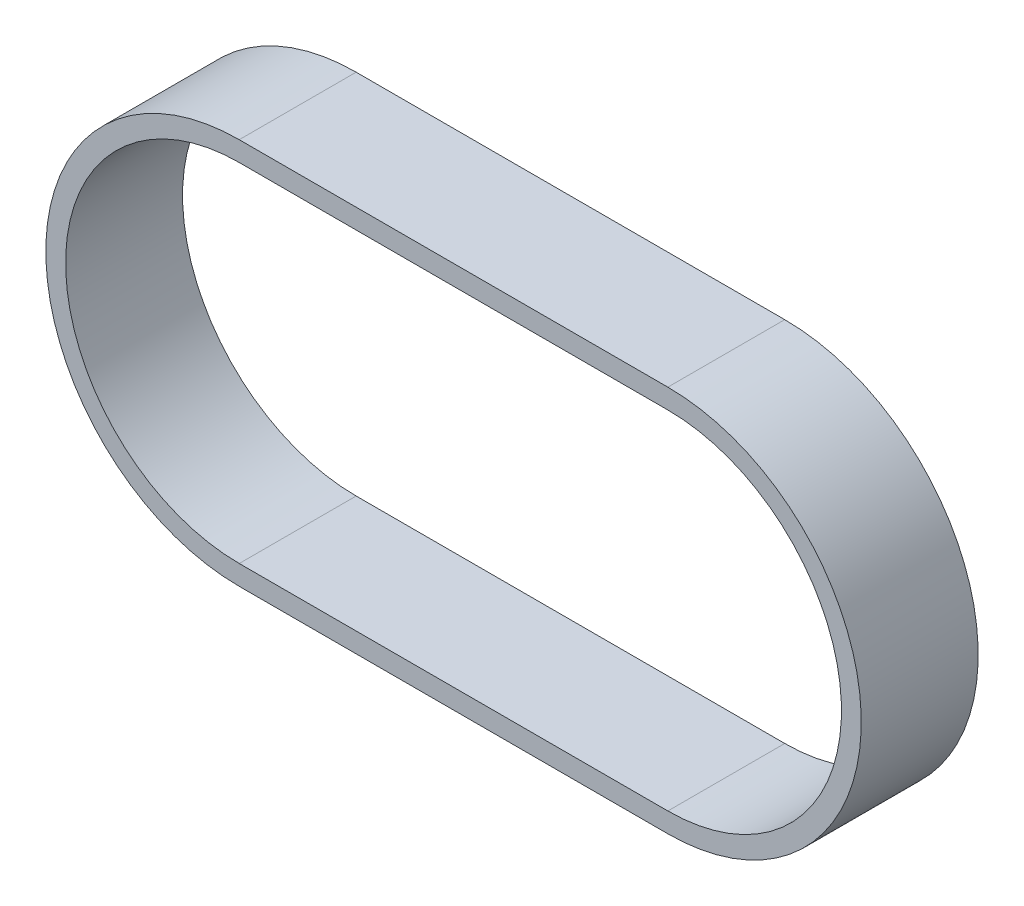
from build123d import *

# Parameters (mm, degrees)
BOSS_EXTRUDE1_DEPTH = 15


with BuildPart() as part:
    # Sketch1 → Boss-Extrude1 (new body)
    with BuildSketch(Plane.XY):
        with BuildLine():
            Line((0, 24.8158), (54.991, 24.8158))
            ThreePointArc((54.991, 24.8158), (79.8068, 0), (54.991, -24.8158))
            Line((54.991, -24.8158), (0, -24.8158))
            ThreePointArc((0, -24.8158), (-24.8158, 0), (0, 24.8158))
        make_face()
        with BuildLine():
            Line((0, 22.2758), (54.991, 22.2758))
            ThreePointArc((54.991, 22.2758), (77.2668, 0), (54.991, -22.2758))
            Line((54.991, -22.2758), (0, -22.2758))
            ThreePointArc((0, -22.2758), (-22.2758, 0), (0, 22.2758))
        make_face(mode=Mode.SUBTRACT)
    extrude(amount=BOSS_EXTRUDE1_DEPTH)


solid = part.part
